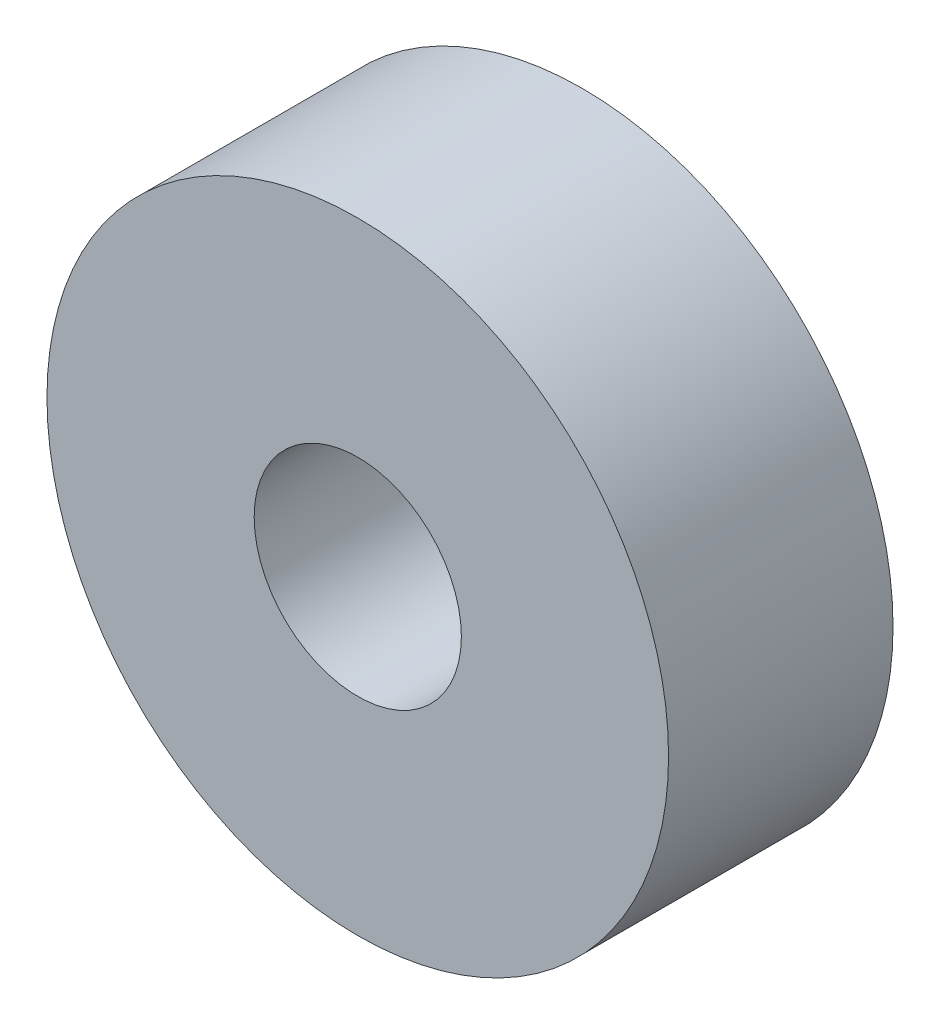
from build123d import *

# Parameters (mm, degrees)
SKETCH_1_R      = 9
SKETCH_1_R_2    = 3
EXTRUDE_2_DEPTH = 6.5


with BuildPart() as part:
    # Эскиз1 → Вытянуть2 (new body)
    with BuildSketch(Plane.XY):
        with Locations(Location((0, 0, 0), (0, 0, 180))):
            Circle(SKETCH_1_R)
        with Locations(Location((0, 0, 0), (0, 0, 180))):
            Circle(SKETCH_1_R_2, mode=Mode.SUBTRACT)
    extrude(amount=EXTRUDE_2_DEPTH)


solid = part.part
